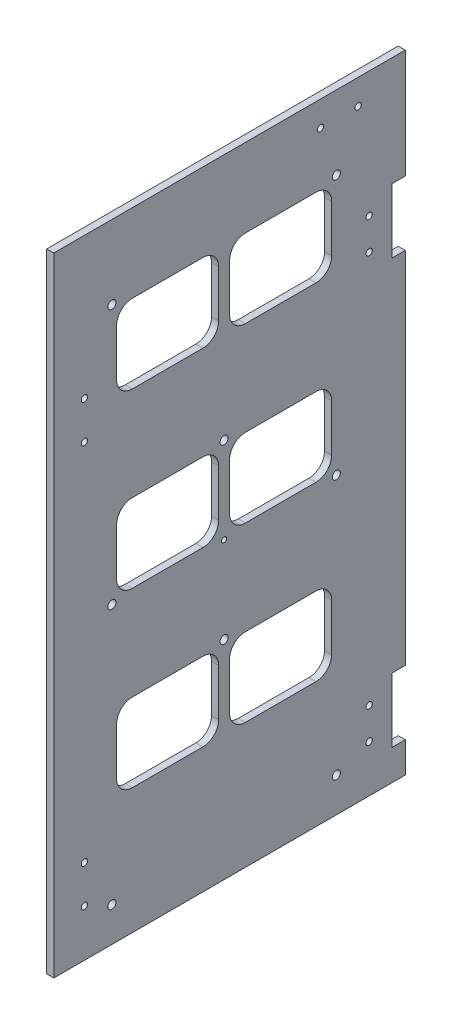
from build123d import *

# Parameters (mm, degrees)
SKETCH_1_W          = 223.9
SKETCH_1_H          = 400
EXTRUDE_1_DEPTH     = 4.5
SKETCH_2_R          = 2
SKETCH_2_W          = 8.5
SKETCH_2_H          = 41
CUT_EXTRUDE_1_DEPTH = 10
CUT_EXTRUDE_2_REACH = 460.423
SKETCH_3_R          = 2.6
SKETCH_3_R_2        = 1.6


with BuildPart() as part:
    # 草图1 → 凸台-拉伸1 (new body)
    with BuildSketch(Plane(origin=(0, 0, 0), x_dir=(0, 0, -1), z_dir=(1, 0, 0))):
        with Locations((-111.95, 200)):
            Rectangle(SKETCH_1_W, SKETCH_1_H)
    extrude(amount=EXTRUDE_1_DEPTH)

    # 草图2 → 切除-拉伸1 (cut)
    with BuildSketch(Plane(origin=(4.5, 0, 0), x_dir=(0, 0, -1), z_dir=(1, 0, 0))):
        with Locations((-204.4, 310)):
            Circle(SKETCH_2_R)
        with Locations((-204.4, 286)):
            Circle(SKETCH_2_R)
        with Locations((-204.4, 54)):
            Circle(SKETCH_2_R)
        with Locations((-204.4, 30)):
            Circle(SKETCH_2_R)
        with Locations((-54, 384)):
            Circle(SKETCH_2_R)
        with Locations((-30, 384)):
            Circle(SKETCH_2_R)
        with Locations((-23, 320)):
            Circle(SKETCH_2_R)
        with Locations((-23, 300)):
            Circle(SKETCH_2_R)
        with Locations((-23, 50)):
            Circle(SKETCH_2_R)
        with Locations((-23, 30)):
            Circle(SKETCH_2_R)
        with Locations((-4.25, 310)):
            Rectangle(SKETCH_2_W, SKETCH_2_H)
        with Locations((-4.25, 40)):
            Rectangle(SKETCH_2_W, SKETCH_2_H)
    extrude(amount=-CUT_EXTRUDE_1_DEPTH, mode=Mode.SUBTRACT)

    # 草图3 → 切除-拉伸2 (cut, up to next)
    with BuildSketch(Plane(origin=(4.5, 0, 0), x_dir=(0, 0, -1), z_dir=(1, 0, 0)), mode=Mode.PRIVATE) as cut_extrude_2_sk1:
        with Locations((-43.9, 22)):
            Circle(SKETCH_3_R)
    cut_extrude_2_tool1 = extrude(cut_extrude_2_sk1.sketch, amount=-CUT_EXTRUDE_2_REACH, mode=Mode.PRIVATE) & part.part
    # 草图3 → 切除-拉伸2 (cut, up to next)
    with BuildSketch(Plane(origin=(4.5, 0, 0), x_dir=(0, 0, -1), z_dir=(1, 0, 0)), mode=Mode.PRIVATE) as cut_extrude_2_sk2:
        with Locations((-186.9, 22)):
            Circle(SKETCH_3_R)
    cut_extrude_2_tool2 = extrude(cut_extrude_2_sk2.sketch, amount=-CUT_EXTRUDE_2_REACH, mode=Mode.PRIVATE) & part.part
    # 草图3 → 切除-拉伸2 (cut, up to next)
    with BuildSketch(Plane(origin=(4.5, 0, 0), x_dir=(0, 0, -1), z_dir=(1, 0, 0)), mode=Mode.PRIVATE) as cut_extrude_2_sk3:
        with Locations((-43.9, 187.5)):
            Circle(SKETCH_3_R)
    cut_extrude_2_tool3 = extrude(cut_extrude_2_sk3.sketch, amount=-CUT_EXTRUDE_2_REACH, mode=Mode.PRIVATE) & part.part
    # 草图3 → 切除-拉伸2 (cut, up to next)
    with BuildSketch(Plane(origin=(4.5, 0, 0), x_dir=(0, 0, -1), z_dir=(1, 0, 0)), mode=Mode.PRIVATE) as cut_extrude_2_sk4:
        with Locations((-186.9, 187.5)):
            Circle(SKETCH_3_R)
    cut_extrude_2_tool4 = extrude(cut_extrude_2_sk4.sketch, amount=-CUT_EXTRUDE_2_REACH, mode=Mode.PRIVATE) & part.part
    # 草图3 → 切除-拉伸2 (cut, up to next)
    with BuildSketch(Plane(origin=(4.5, 0, 0), x_dir=(0, 0, -1), z_dir=(1, 0, 0)), mode=Mode.PRIVATE) as cut_extrude_2_sk5:
        with Locations((-186.9, 353)):
            Circle(SKETCH_3_R)
    cut_extrude_2_tool5 = extrude(cut_extrude_2_sk5.sketch, amount=-CUT_EXTRUDE_2_REACH, mode=Mode.PRIVATE) & part.part
    # 草图3 → 切除-拉伸2 (cut, up to next)
    with BuildSketch(Plane(origin=(4.5, 0, 0), x_dir=(0, 0, -1), z_dir=(1, 0, 0)), mode=Mode.PRIVATE) as cut_extrude_2_sk6:
        with Locations((-43.9, 353)):
            Circle(SKETCH_3_R)
    cut_extrude_2_tool6 = extrude(cut_extrude_2_sk6.sketch, amount=-CUT_EXTRUDE_2_REACH, mode=Mode.PRIVATE) & part.part
    # 草图3 → 切除-拉伸2 (cut, up to next)
    with BuildSketch(Plane(origin=(4.5, 0, 0), x_dir=(0, 0, -1), z_dir=(1, 0, 0)), mode=Mode.PRIVATE) as cut_extrude_2_sk7:
        with Locations((-115.4, 187.5)):
            Circle(SKETCH_3_R_2)
    cut_extrude_2_tool7 = extrude(cut_extrude_2_sk7.sketch, amount=-CUT_EXTRUDE_2_REACH, mode=Mode.PRIVATE) & part.part
    # 草图3 → 切除-拉伸2 (cut, up to next)
    with BuildSketch(Plane(origin=(4.5, 0, 0), x_dir=(0, 0, -1), z_dir=(1, 0, 0)), mode=Mode.PRIVATE) as cut_extrude_2_sk8:
        with Locations((-115.4, 242.5)):
            Circle(SKETCH_3_R)
    cut_extrude_2_tool8 = extrude(cut_extrude_2_sk8.sketch, amount=-CUT_EXTRUDE_2_REACH, mode=Mode.PRIVATE) & part.part
    # 草图3 → 切除-拉伸2 (cut, up to next)
    with BuildSketch(Plane(origin=(4.5, 0, 0), x_dir=(0, 0, -1), z_dir=(1, 0, 0)), mode=Mode.PRIVATE) as cut_extrude_2_sk9:
        with Locations((-115.4, 132.5)):
            Circle(SKETCH_3_R)
    cut_extrude_2_tool9 = extrude(cut_extrude_2_sk9.sketch, amount=-CUT_EXTRUDE_2_REACH, mode=Mode.PRIVATE) & part.part
    # 草图3 → 切除-拉伸2 (cut, up to next)
    with BuildSketch(Plane(origin=(4.5, 0, 0), x_dir=(0, 0, -1), z_dir=(1, 0, 0)), mode=Mode.PRIVATE) as cut_extrude_2_sk10:
        with BuildLine():
            Line((-173.9, 130), (-128.9, 130))
            ThreePointArc((-128.9, 130), (-121.828932188, 127.071067812), (-118.9, 120))
            Line((-118.9, 120), (-118.9, 90))
            ThreePointArc((-118.9, 90), (-121.828932188, 82.928932188), (-128.9, 80))
            Line((-128.9, 80), (-173.9, 80))
            ThreePointArc((-173.9, 80), (-180.971067812, 82.928932188), (-183.9, 90))
            Line((-183.9, 90), (-183.9, 120))
            ThreePointArc((-183.9, 120), (-180.971067812, 127.071067812), (-173.9, 130))
        make_face()
    cut_extrude_2_tool10 = extrude(cut_extrude_2_sk10.sketch, amount=-CUT_EXTRUDE_2_REACH, mode=Mode.PRIVATE) & part.part
    # 草图3 → 切除-拉伸2 (cut, up to next)
    with BuildSketch(Plane(origin=(4.5, 0, 0), x_dir=(0, 0, -1), z_dir=(1, 0, 0)), mode=Mode.PRIVATE) as cut_extrude_2_sk11:
        with BuildLine():
            Line((-101.9, 130), (-56.9, 130))
            ThreePointArc((-56.9, 130), (-49.828932188, 127.071067812), (-46.9, 120))
            Line((-46.9, 120), (-46.9, 90))
            ThreePointArc((-46.9, 90), (-49.828932188, 82.928932188), (-56.9, 80))
            Line((-56.9, 80), (-101.9, 80))
            ThreePointArc((-101.9, 80), (-108.971067812, 82.928932188), (-111.9, 90))
            Line((-111.9, 90), (-111.9, 120))
            ThreePointArc((-111.9, 120), (-108.971067812, 127.071067812), (-101.9, 130))
        make_face()
    cut_extrude_2_tool11 = extrude(cut_extrude_2_sk11.sketch, amount=-CUT_EXTRUDE_2_REACH, mode=Mode.PRIVATE) & part.part
    # 草图3 → 切除-拉伸2 (cut, up to next)
    with BuildSketch(Plane(origin=(4.5, 0, 0), x_dir=(0, 0, -1), z_dir=(1, 0, 0)), mode=Mode.PRIVATE) as cut_extrude_2_sk12:
        with BuildLine():
            Line((-101.9, 240), (-56.9, 240))
            ThreePointArc((-56.9, 240), (-49.828932188, 237.071067812), (-46.9, 230))
            Line((-46.9, 230), (-46.9, 200))
            ThreePointArc((-46.9, 200), (-49.828932188, 192.928932188), (-56.9, 190))
            Line((-56.9, 190), (-101.9, 190))
            ThreePointArc((-101.9, 190), (-108.971067812, 192.928932188), (-111.9, 200))
            Line((-111.9, 200), (-111.9, 230))
            ThreePointArc((-111.9, 230), (-108.971067812, 237.071067812), (-101.9, 240))
        make_face()
    cut_extrude_2_tool12 = extrude(cut_extrude_2_sk12.sketch, amount=-CUT_EXTRUDE_2_REACH, mode=Mode.PRIVATE) & part.part
    # 草图3 → 切除-拉伸2 (cut, up to next)
    with BuildSketch(Plane(origin=(4.5, 0, 0), x_dir=(0, 0, -1), z_dir=(1, 0, 0)), mode=Mode.PRIVATE) as cut_extrude_2_sk13:
        with BuildLine():
            Line((-101.9, 350), (-56.9, 350))
            ThreePointArc((-56.9, 350), (-49.828932188, 347.071067812), (-46.9, 340))
            Line((-46.9, 340), (-46.9, 310))
            ThreePointArc((-46.9, 310), (-49.828932188, 302.928932188), (-56.9, 300))
            Line((-56.9, 300), (-101.9, 300))
            ThreePointArc((-101.9, 300), (-108.971067812, 302.928932188), (-111.9, 310))
            Line((-111.9, 310), (-111.9, 340))
            ThreePointArc((-111.9, 340), (-108.971067812, 347.071067812), (-101.9, 350))
        make_face()
    cut_extrude_2_tool13 = extrude(cut_extrude_2_sk13.sketch, amount=-CUT_EXTRUDE_2_REACH, mode=Mode.PRIVATE) & part.part
    # 草图3 → 切除-拉伸2 (cut, up to next)
    with BuildSketch(Plane(origin=(4.5, 0, 0), x_dir=(0, 0, -1), z_dir=(1, 0, 0)), mode=Mode.PRIVATE) as cut_extrude_2_sk14:
        with BuildLine():
            Line((-173.9, 240), (-128.9, 240))
            ThreePointArc((-128.9, 240), (-121.828932188, 237.071067812), (-118.9, 230))
            Line((-118.9, 230), (-118.9, 200))
            ThreePointArc((-118.9, 200), (-121.828932188, 192.928932188), (-128.9, 190))
            Line((-128.9, 190), (-173.9, 190))
            ThreePointArc((-173.9, 190), (-180.971067812, 192.928932188), (-183.9, 200))
            Line((-183.9, 200), (-183.9, 230))
            ThreePointArc((-183.9, 230), (-180.971067812, 237.071067812), (-173.9, 240))
        make_face()
    cut_extrude_2_tool14 = extrude(cut_extrude_2_sk14.sketch, amount=-CUT_EXTRUDE_2_REACH, mode=Mode.PRIVATE) & part.part
    # 草图3 → 切除-拉伸2 (cut, up to next)
    with BuildSketch(Plane(origin=(4.5, 0, 0), x_dir=(0, 0, -1), z_dir=(1, 0, 0)), mode=Mode.PRIVATE) as cut_extrude_2_sk15:
        with BuildLine():
            Line((-173.9, 350), (-128.9, 350))
            ThreePointArc((-128.9, 350), (-121.828932188, 347.071067812), (-118.9, 340))
            Line((-118.9, 340), (-118.9, 310))
            ThreePointArc((-118.9, 310), (-121.828932188, 302.928932188), (-128.9, 300))
            Line((-128.9, 300), (-173.9, 300))
            ThreePointArc((-173.9, 300), (-180.971067812, 302.928932188), (-183.9, 310))
            Line((-183.9, 310), (-183.9, 340))
            ThreePointArc((-183.9, 340), (-180.971067812, 347.071067812), (-173.9, 350))
        make_face()
    cut_extrude_2_tool15 = extrude(cut_extrude_2_sk15.sketch, amount=-CUT_EXTRUDE_2_REACH, mode=Mode.PRIVATE) & part.part
    add(cut_extrude_2_tool1.solids().sort_by_distance((4.5, 22, 43.9))[0], mode=Mode.SUBTRACT)
    add(cut_extrude_2_tool2.solids().sort_by_distance((4.5, 22, 186.9))[0], mode=Mode.SUBTRACT)
    add(cut_extrude_2_tool3.solids().sort_by_distance((4.5, 187.5, 43.9))[0], mode=Mode.SUBTRACT)
    add(cut_extrude_2_tool4.solids().sort_by_distance((4.5, 187.5, 186.9))[0], mode=Mode.SUBTRACT)
    add(cut_extrude_2_tool5.solids().sort_by_distance((4.5, 353, 186.9))[0], mode=Mode.SUBTRACT)
    add(cut_extrude_2_tool6.solids().sort_by_distance((4.5, 353, 43.9))[0], mode=Mode.SUBTRACT)
    add(cut_extrude_2_tool7.solids().sort_by_distance((4.5, 187.5, 115.4))[0], mode=Mode.SUBTRACT)
    add(cut_extrude_2_tool8.solids().sort_by_distance((4.5, 242.5, 115.4))[0], mode=Mode.SUBTRACT)
    add(cut_extrude_2_tool9.solids().sort_by_distance((4.5, 132.5, 115.4))[0], mode=Mode.SUBTRACT)
    add(cut_extrude_2_tool10.solids().sort_by_distance((4.5, 105, 151.4))[0], mode=Mode.SUBTRACT)
    add(cut_extrude_2_tool11.solids().sort_by_distance((4.5, 105, 79.4))[0], mode=Mode.SUBTRACT)
    add(cut_extrude_2_tool12.solids().sort_by_distance((4.5, 215, 79.4))[0], mode=Mode.SUBTRACT)
    add(cut_extrude_2_tool13.solids().sort_by_distance((4.5, 325, 79.4))[0], mode=Mode.SUBTRACT)
    add(cut_extrude_2_tool14.solids().sort_by_distance((4.5, 215, 151.4))[0], mode=Mode.SUBTRACT)
    add(cut_extrude_2_tool15.solids().sort_by_distance((4.5, 325, 151.4))[0], mode=Mode.SUBTRACT)


solid = part.part
